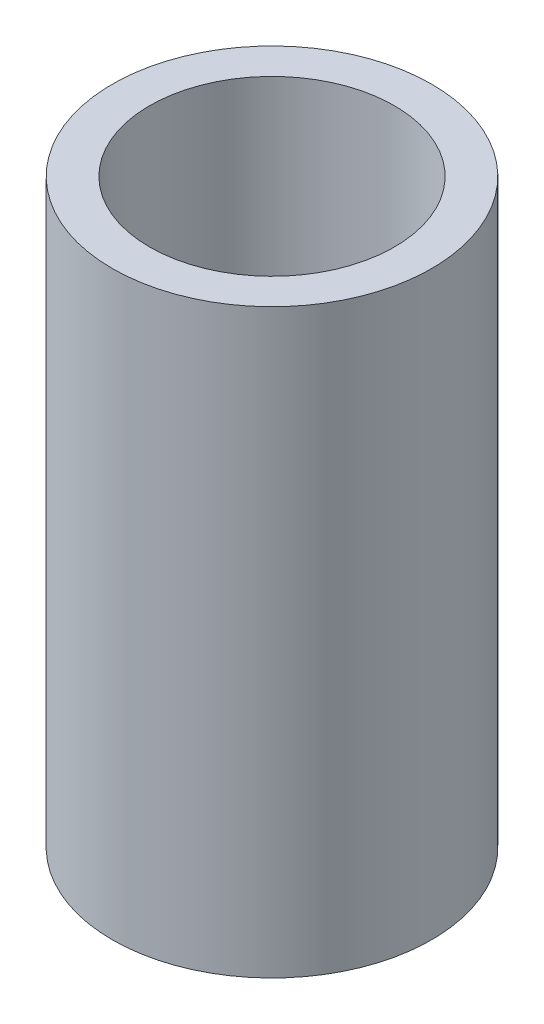
from build123d import *

# Parameters (mm, degrees)
SKETCH1_R           = 3
SKETCH1_R_2         = 2.3
BOSS_EXTRUDE1_DEPTH = 10.922


with BuildPart() as part:
    # Sketch1 → Boss-Extrude1 (new body)
    with BuildSketch(Plane(origin=(0, 0, 0), x_dir=(1, 0, 0), z_dir=(0, 1, 0))):
        with Locations(Location((0, 0, 0), (0, 0, 270))):
            Circle(SKETCH1_R)
        with Locations(Location((0, 0, 0), (0, 0, 270))):
            Circle(SKETCH1_R_2, mode=Mode.SUBTRACT)
    extrude(amount=BOSS_EXTRUDE1_DEPTH)


solid = part.part
